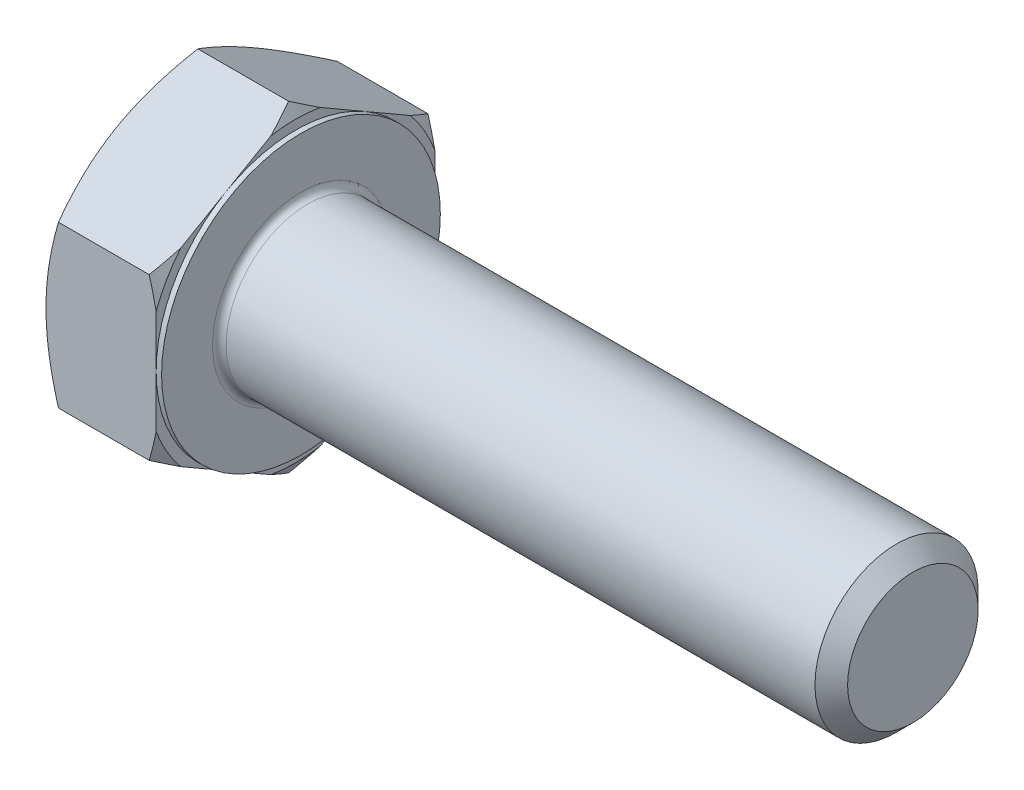
from build123d import *

# Parameters (mm, degrees)
EXTRUDE_360_DEPTH = 17
SKETCH_4_W        = 0.8
SKETCH_4_H        = 13.171361037
CHAMFER_1926_SIZE = 2.4
FILLET_1982_R     = 1


with BuildPart() as part:
    # 草图1 → Extrude 360 (new body)
    with BuildSketch(Plane(origin=(0, 0, 0), x_dir=(0, 0, -1), z_dir=(1, 0, 0))):
        Polygon((20.5, 11.835680518), (20.5, -11.835680518), (0, -23.671361037), (-20.5, -11.835680518), (-20.5, 11.835680518), (0, 23.671361037), align=None)
    extrude(amount=EXTRUDE_360_DEPTH)

    # 草图2 → 凸台-旋转1 (revolve)
    with BuildSketch(Plane.XY, mode=Mode.PRIVATE) as revolve_1_sk:
        Polygon((0, 0), (107, 0), (107, 9.402), (107, 12), (0, 12), align=None)
    revolve(revolve_1_sk.sketch.rotate(Axis((0, 0, 0), (1, 0, 0)), 90), axis=Axis((0, 0, 0), (1, 0, 0)))

    # 草图3 → 切除-旋转1 (revolve, cut)
    with BuildSketch(Plane.XY):
        Polygon((0, 20.5), (4.717737494, 28.671361037), (4.717737494, 33.671361037), (-10, 33.671361037), (-10, 20.5), align=None)
    revolve(axis=Axis((0, 0, 0), (1, 0, 0)), mode=Mode.SUBTRACT)

    # 草图5 → 切除-旋转2 (revolve, cut)
    with BuildSketch(Plane.XY):
        Polygon((17, 20.5), (12.282262506, 28.671361037), (12.282262506, 33.671361037), (22.282262506, 33.671361037), (22.282262506, 20.5), align=None)
    revolve(axis=Axis((0, 0, 0), (1, 0, 0)), mode=Mode.SUBTRACT)

    # 草图4 → 切除-旋转3 (revolve, cut)
    with BuildSketch(Plane.XY, mode=Mode.PRIVATE) as cut_revolve_3_sk:
        with Locations((16.6, 27.085680519)):
            Rectangle(SKETCH_4_W, SKETCH_4_H)
    revolve(cut_revolve_3_sk.sketch.rotate(Axis((0, 0, 0), (1, 0, 0)), 270), axis=Axis((0, 0, 0), (1, 0, 0)), mode=Mode.SUBTRACT)

    # Chamfer 1926
    chamfer_1926_edges = [part.edges().sort_by_distance(p)[0] for p in [
        (107, 0, -12),
    ]]
    chamfer(chamfer_1926_edges, length=CHAMFER_1926_SIZE)

    # Fillet 1982
    fillet_1982_edges = [part.edges().sort_by_distance(p)[0] for p in [
        (17, 0, -12),
    ]]
    fillet(fillet_1982_edges, radius=FILLET_1982_R)


solid = part.part
